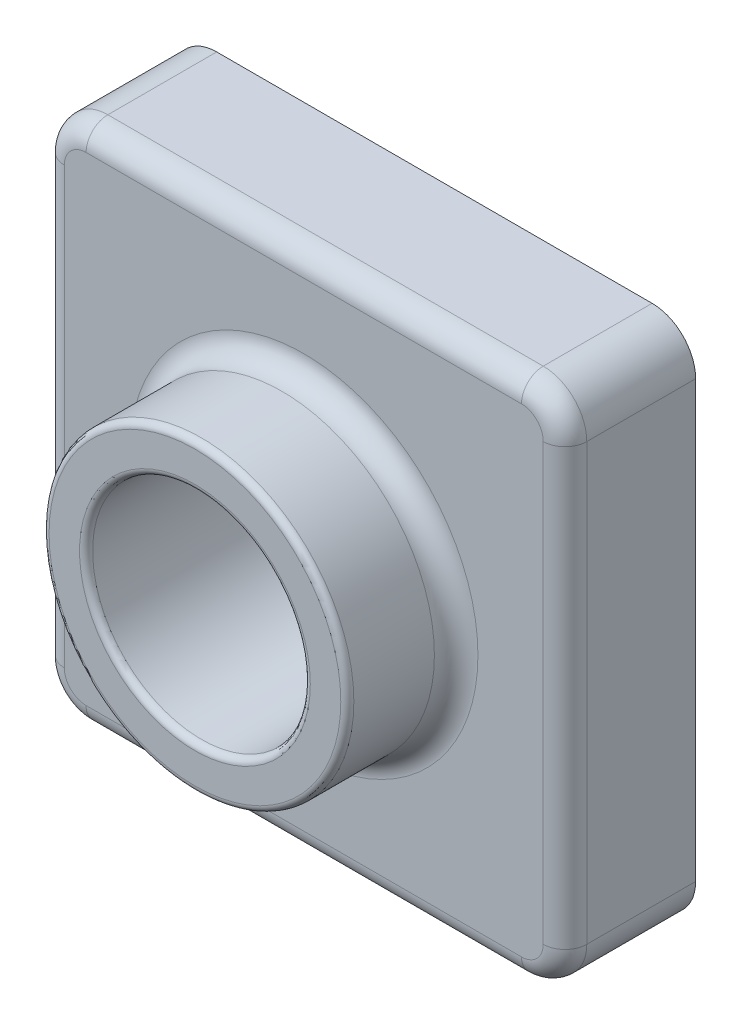
from build123d import *

# Parameters (mm, degrees)
SKETCH1_W           = 120
SKETCH1_H           = 120
BOSS_EXTRUDE1_DEPTH = 30
SKETCH2_R           = 35
BOSS_EXTRUDE2_DEPTH = 25
SKETCH3_R           = 25
CUT_EXTRUDE1_DEPTH  = 179.395627749
FILLET1_R           = 10
FILLET2_R           = 1.5
FILLET3_R           = 5
SHELL1_T            = -2


with BuildPart() as part:
    # Sketch1 → Boss-Extrude1 (new body)
    with BuildSketch(Plane.XY):
        with Locations((60, 60)):
            Rectangle(SKETCH1_W, SKETCH1_H)
    extrude(amount=BOSS_EXTRUDE1_DEPTH)

    # Sketch2 → Boss-Extrude2 (add)
    with BuildSketch(Plane.XY.offset(30)):
        with Locations((60, 60)):
            Circle(SKETCH2_R)
    extrude(amount=BOSS_EXTRUDE2_DEPTH)

    # Sketch3 → Cut-Extrude1 (cut, through all)
    with BuildSketch(Plane.XY.offset(55)):
        with Locations((60, 60)):
            Circle(SKETCH3_R)
    extrude(amount=-CUT_EXTRUDE1_DEPTH, mode=Mode.SUBTRACT)

    # Fillet1
    fillet1_edges = [part.edges().sort_by_distance(p)[0] for p in [
        (0, 120, 15),
        (120, 120, 15),
        (120, 0, 15),
        (0, 0, 15),
    ]]
    fillet(fillet1_edges, radius=FILLET1_R)

    # Fillet2
    fillet2_edges = [part.edges().sort_by_distance(p)[0] for p in [
        (25, 60, 55),
        (35, 60, 55),
    ]]
    fillet(fillet2_edges, radius=FILLET2_R)

    # Fillet3
    fillet3_edges = [part.edges().sort_by_distance(p)[0] for p in [
        (25, 60, 30),
        (60, 0, 30),
        (0, 60, 30),
        (120, 60, 30),
        (60, 120, 30),
        (117.071067812, 2.928932188, 30),
        (117.071067812, 117.071067812, 30),
        (2.928932188, 117.071067812, 30),
        (2.928932188, 2.928932188, 30),
    ]]
    fillet(fillet3_edges, radius=FILLET3_R)

    # Shell1
    shell1_openings = [part.faces().sort_by_distance(p)[0] for p in [
        (60, 1.697056275, 0),
    ]]
    offset(amount=SHELL1_T, openings=shell1_openings, kind=Kind.INTERSECTION)


solid = part.part
